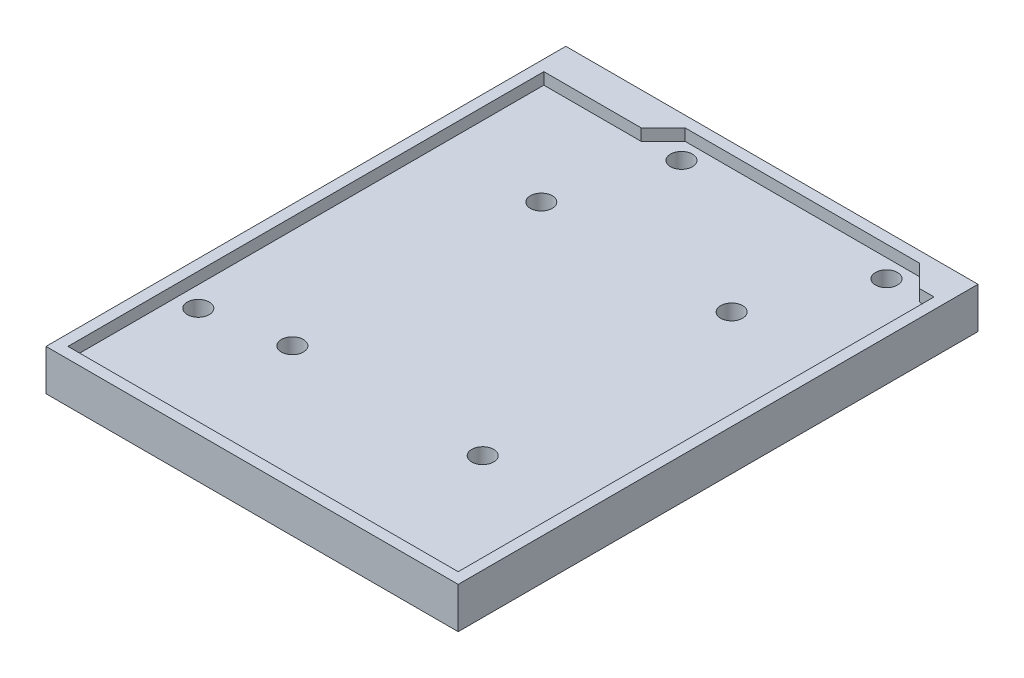
from build123d import *

# Parameters (mm, degrees)
SKETCH1_W           = 56.3
SKETCH1_H           = 71
BOSS_EXTRUDE1_DEPTH = 5.6
CUT_EXTRUDE1_DEPTH  = 1.6
SKETCH3_R           = 1.5
CUT_EXTRUDE2_DEPTH  = 4
SKETCH5_R           = 1.5
CUT_EXTRUDE3_DEPTH  = 4


with BuildPart() as part:
    # Sketch1 → Boss-Extrude1 (new body)
    with BuildSketch(Plane(origin=(0, 0, 0), x_dir=(1, 0, 0), z_dir=(0, 1, 0))):
        Rectangle(SKETCH1_W, SKETCH1_H)
    extrude(amount=BOSS_EXTRUDE1_DEPTH)

    # Sketch2 → Cut-Extrude1 (cut)
    with BuildSketch(Plane(origin=(0, 5.6, 0), x_dir=(1, 0, 0), z_dir=(0, 1, 0))):
        Polygon((26.65, -34), (-26.65, -34), (-26.65, 31), (-13.35, 31), (-10.35, 34), (21.65, 34), (24.65, 31), (26.65, 31), align=None)
    extrude(amount=-CUT_EXTRUDE1_DEPTH, mode=Mode.SUBTRACT)

    # Sketch3 → Cut-Extrude2 (cut)
    with BuildSketch(Plane(origin=(0, 4, 0), x_dir=(1, 0, 0), z_dir=(0, 1, 0))):
        with Locations(Location((-8.35, 31.5, 0), (0, 0, 270))):
            Circle(SKETCH3_R)
        with Locations(Location((19.65, 31.5, 0), (0, 0, 270))):
            Circle(SKETCH3_R)
        with Locations(Location((-23.85, -19, 0), (0, 0, 270))):
            Circle(SKETCH3_R)
    extrude(amount=-CUT_EXTRUDE2_DEPTH, mode=Mode.SUBTRACT)

    # Sketch5 → Cut-Extrude3 (cut)
    with BuildSketch(Plane(origin=(0, 4, 0), x_dir=(1, 0, 0), z_dir=(0, 1, 0))):
        with Locations(Location((-13, 17, 0), (0, 0, 270))):
            Circle(SKETCH5_R)
        with Locations(Location((13, -17, 0), (0, 0, 270))):
            Circle(SKETCH5_R)
        with Locations(Location((13, 17, 0), (0, 0, 270))):
            Circle(SKETCH5_R)
        with Locations(Location((-13, -17, 0), (0, 0, 270))):
            Circle(SKETCH5_R)
    extrude(amount=-CUT_EXTRUDE3_DEPTH, mode=Mode.SUBTRACT)


solid = part.part
